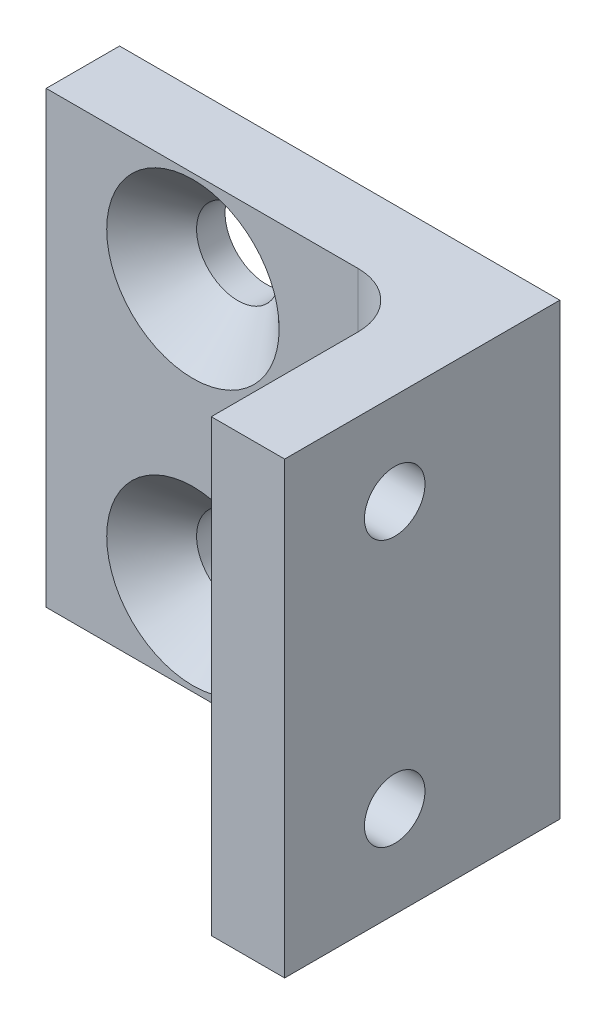
from build123d import *

# Parameters (mm, degrees)
BOSS_EXTRUDE1_DEPTH                            = 24.5
CSK_FOR_M4_FLAT_HEAD_MACHINE_SCREW1_AT_2_COUNT = 2
CSK_FOR_M4_FLAT_HEAD_MACHINE_SCREW1_AT_2_PITCH = 14.5
TAP_DRILL_FOR_M4X0_7_TAP1_D                    = 3.3
FILLET1_R                                      = 3


with BuildPart() as part:
    # Sketch2 → Boss-Extrude1 (new body)
    with BuildSketch(Plane(origin=(0, 0, 0), x_dir=(1, 0, 0), z_dir=(0, 1, 0))):
        Polygon((0, 0), (-24, 0), (-24, -4), (-4, -4), (-4, -15), (0, -15), align=None)
    extrude(amount=BOSS_EXTRUDE1_DEPTH)

    # Sketch5 → CSK for M4 Flat Head Machine Screw1 (revolve, cut)
    with BuildSketch(Plane(origin=(-16, 5, 4), x_dir=(0, -1, 0), z_dir=(1, 0, 0))):
        Polygon((0, 0), (0, 4), (2.25, 4), (2.25, 2.45), (4.7, 0), align=None)
    csk_for_m4_flat_head_machine_screw1 = revolve(axis=Axis((-16, 5, 10.35), (0, 0, -1)), mode=Mode.SUBTRACT)

    # CSK for M4 Flat Head Machine Screw1 at 2: CSK for M4 Flat Head Machine Screw1 ×2
    with Locations(*[(0, i * CSK_FOR_M4_FLAT_HEAD_MACHINE_SCREW1_AT_2_PITCH, 0) for i in range(1, CSK_FOR_M4_FLAT_HEAD_MACHINE_SCREW1_AT_2_COUNT)]):
        add(csk_for_m4_flat_head_machine_screw1, mode=Mode.SUBTRACT)

    # Tap Drill for M4x0.7 Tap1 (through all)
    with Locations(Plane.ZY.offset(4)):
        with Locations((9, 5), (9, 19.5)):
            Hole(TAP_DRILL_FOR_M4X0_7_TAP1_D / 2)

    # Fillet1
    fillet1_edges = [part.edges().sort_by_distance(p)[0] for p in [
        (-4, 12.25, 4),
    ]]
    fillet(fillet1_edges, radius=FILLET1_R)


solid = part.part
